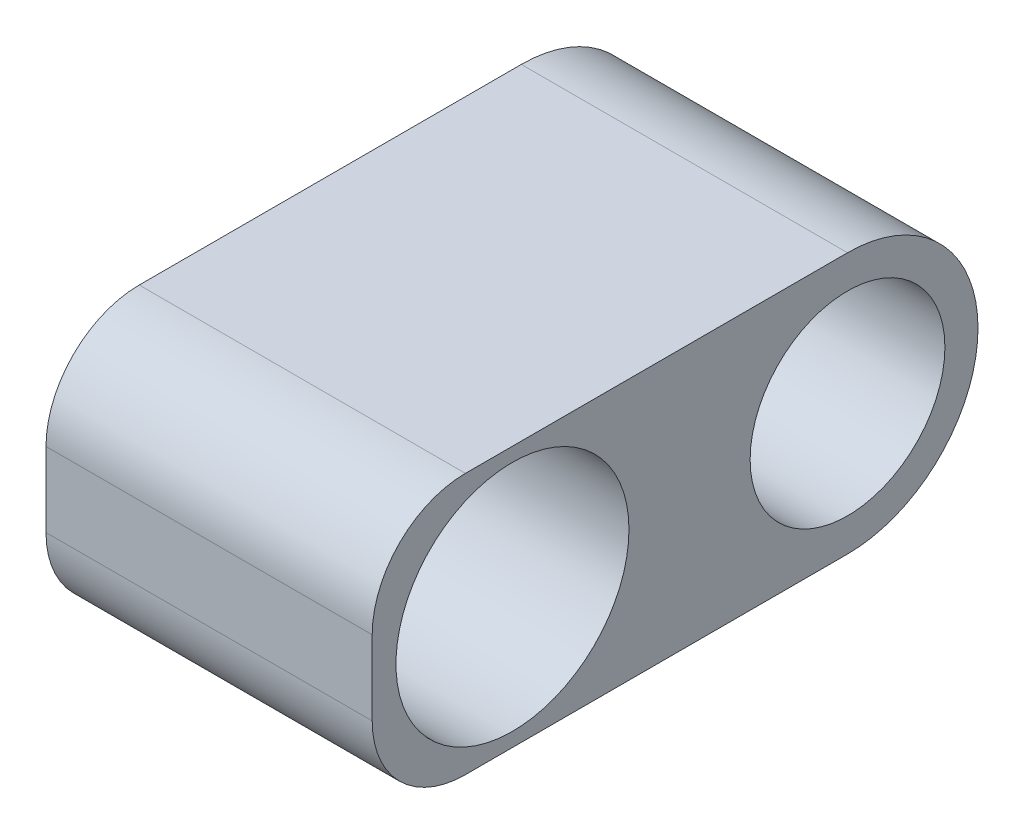
from build123d import *

# Parameters (mm, degrees)
BOSS_EXTRUDE1_START = -17
BOSS_EXTRUDE1_DEPTH = 35
SKETCH2_R           = 10.45
CUT_EXTRUDE1_DEPTH  = 27
SKETCH3_R           = 6.5
CUT_EXTRUDE2_DEPTH  = 60.380131357
SKETCH4_R           = 12.5
CUT_EXTRUDE3_DEPTH  = 64.419239983
FILLET5_R           = 10
FILLET6_R           = 10


with BuildPart() as part:
    # Sketch1 → Boss-Extrude1 (new body)
    with BuildSketch(Plane.YZ.offset(BOSS_EXTRUDE1_START)):
        with BuildLine():
            Line((-14, 0), (-14, 51))
            Line((-14, 51), (14, 51))
            Line((14, 51), (14, 0))
            ThreePointArc((14, 0), (0, -14), (-14, 0))
        make_face()
    extrude(amount=BOSS_EXTRUDE1_DEPTH)

    # Sketch2 → Cut-Extrude1 (cut)
    with BuildSketch(Plane.YZ.offset(18)):
        with Locations(Location((0, 0, 0), (0, 0, 270))):
            Circle(SKETCH2_R)
    extrude(amount=-CUT_EXTRUDE1_DEPTH, mode=Mode.SUBTRACT)

    # Sketch3 → Cut-Extrude2 (cut, through all)
    with BuildSketch(Plane.YZ.offset(-9)):
        with Locations(Location((0, 0, 0), (0, 0, 270))):
            Circle(SKETCH3_R)
    extrude(amount=-CUT_EXTRUDE2_DEPTH, mode=Mode.SUBTRACT)

    # Sketch4 → Cut-Extrude3 (cut, through all)
    with BuildSketch(Plane.YZ.offset(18)):
        with Locations(Location((0, 35.95, 0), (0, 0, 270))):
            Circle(SKETCH4_R)
    extrude(amount=-CUT_EXTRUDE3_DEPTH, mode=Mode.SUBTRACT)

    # Fillet5
    fillet5_edges = [part.edges().sort_by_distance(p)[0] for p in [
        (0.5, 14, 51),
    ]]
    fillet(fillet5_edges, radius=FILLET5_R)

    # Fillet6
    fillet6_edges = [part.edges().sort_by_distance(p)[0] for p in [
        (0.5, -14, 51),
    ]]
    fillet(fillet6_edges, radius=FILLET6_R)


solid = part.part
